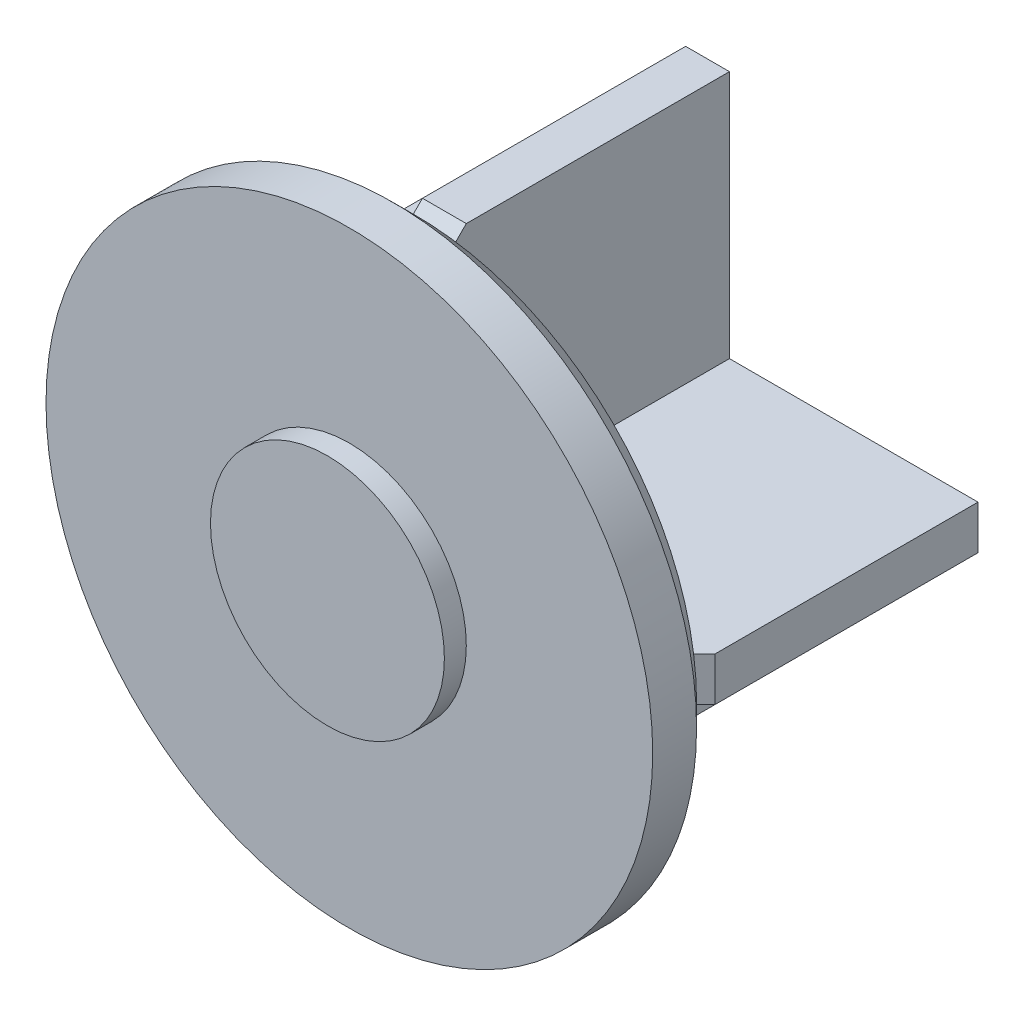
from build123d import *

# Parameters (mm, degrees)
SKETCH1_R           = 41.5
BOSS_EXTRUDE1_DEPTH = 4.5
CHAMFER1_SIZE       = 3
SKETCH3_R           = 16
BOSS_EXTRUDE2_DEPTH = 3
BOSS_EXTRUDE3_DEPTH = 40
CUT_EXTRUDE1_DEPTH  = 76.384016874
CIRPATTERN1_COUNT   = 4


with BuildPart() as part:
    # Sketch1 → Boss-Extrude1 (new, symmetric)
    with BuildSketch(Plane.XY):
        Circle(SKETCH1_R)
    extrude(amount=BOSS_EXTRUDE1_DEPTH, both=True)

    # Chamfer1
    chamfer1_edges = [part.edges().sort_by_distance(p)[0] for p in [
        (-41.5, 0, -4.5),
    ]]
    chamfer(chamfer1_edges, length=CHAMFER1_SIZE)

    # Sketch3 → Boss-Extrude2 (add)
    with BuildSketch(Plane.XY.offset(4.5)):
        Circle(SKETCH3_R)
    extrude(amount=BOSS_EXTRUDE2_DEPTH)

    # Sketch4 → Boss-Extrude3 (add)
    with BuildSketch(Plane(origin=(0, 0, -4.5), x_dir=(-1, 0, 0), z_dir=(0, 0, -1))):
        Polygon((3, -37), (3, -3), (37, -3), (37, 3), (3, 3), (3, 37), (-3, 37), (-3, 3), (-37, 3), (-37, -3), (-3, -3), (-3, -37), align=None)
    extrude(amount=BOSS_EXTRUDE3_DEPTH)

    # Sketch5 → Cut-Extrude1 (cut, symmetric)
    with BuildSketch(Plane.XZ.offset(3)):
        Polygon((37, -4.5), (37, -8.5), (33, -4.5), align=None)
    cut_extrude1 = extrude(amount=CUT_EXTRUDE1_DEPTH, both=True, mode=Mode.SUBTRACT)

    # CirPattern1: Cut-Extrude1 ×4 about axis
    cirpattern1_axis = Axis((0, 0, 0), (0, 0, 1))
    for i in range(1, CIRPATTERN1_COUNT):
        add(cut_extrude1.rotate(cirpattern1_axis, i * 360 / CIRPATTERN1_COUNT), mode=Mode.SUBTRACT)


solid = part.part
